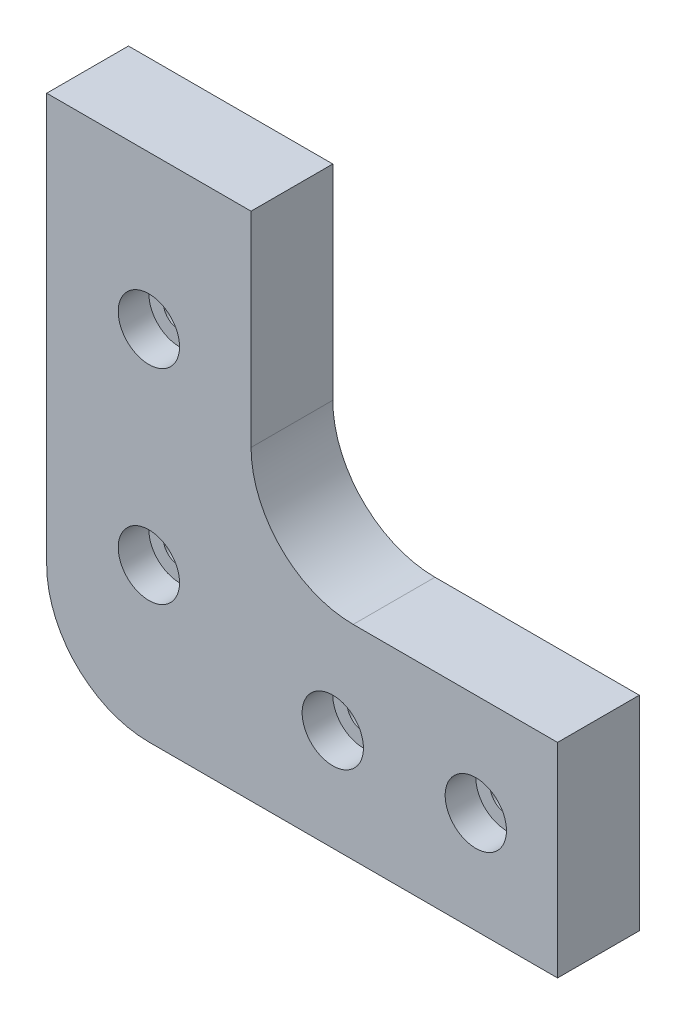
from build123d import *

# Parameters (mm, degrees)
SKETCH_1_R          = 1.6
EXTRUDE_1_DEPTH     = 8
SKETCH_2_R          = 3
CUT_EXTRUDE_1_DEPTH = 3
FILLET_1_R          = 10


with BuildPart() as part:
    # 草图1 → 凸台-拉伸1 (new body)
    with BuildSketch(Plane.XY):
        Polygon((-10, -110), (10, -110), (10, -140.028839027), (40, -140.028839027), (40, -160), (-10, -160), align=None)
        with Locations((0, -125)):
            Circle(SKETCH_1_R, mode=Mode.SUBTRACT)
        with Locations((0, -145)):
            Circle(SKETCH_1_R, mode=Mode.SUBTRACT)
        with Locations((18, -150.014419513)):
            Circle(SKETCH_1_R, mode=Mode.SUBTRACT)
        with Locations((32, -150.014419513)):
            Circle(SKETCH_1_R, mode=Mode.SUBTRACT)
    extrude(amount=EXTRUDE_1_DEPTH)

    # 草图2 → 切除-拉伸1 (cut)
    with BuildSketch(Plane.XY.offset(8)):
        with Locations((32, -150.014419513)):
            Circle(SKETCH_2_R)
        with Locations((18, -150.014419513)):
            Circle(SKETCH_2_R)
        with Locations((0, -145)):
            Circle(SKETCH_2_R)
        with Locations((0, -125)):
            Circle(SKETCH_2_R)
    extrude(amount=-CUT_EXTRUDE_1_DEPTH, mode=Mode.SUBTRACT)

    # 圆角1
    fillet_1_edges = [part.edges().sort_by_distance(p)[0] for p in [
        (10, -140.028839027, 4),
        (-10, -160, 4),
    ]]
    fillet(fillet_1_edges, radius=FILLET_1_R)


solid = part.part
